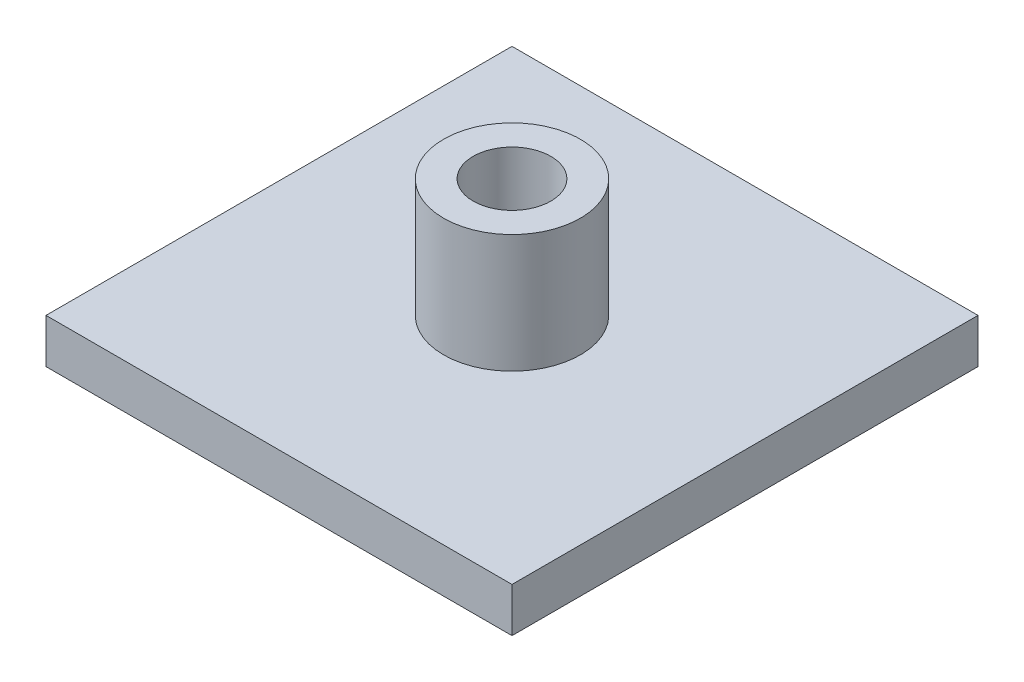
from build123d import *

# Parameters (mm, degrees)
SKETCH1_W           = 31.5
SKETCH1_H           = 31.5
BOSS_EXTRUDE1_DEPTH = 3
SKETCH2_R           = 4.625
SKETCH2_R_2         = 2.625
BOSS_EXTRUDE2_DEPTH = 8


with BuildPart() as part:
    # Sketch1 → Boss-Extrude1 (new body)
    with BuildSketch(Plane(origin=(0, 0, 0), x_dir=(1, 0, 0), z_dir=(0, 1, 0))):
        with Locations((15.75, 15.75)):
            Rectangle(SKETCH1_W, SKETCH1_H)
    extrude(amount=BOSS_EXTRUDE1_DEPTH)

    # Sketch2 → Boss-Extrude2 (add)
    with BuildSketch(Plane(origin=(0, 3, 0), x_dir=(1, 0, 0), z_dir=(0, 1, 0))):
        with Locations(Location((15.75, 15.75, 0), (0, 0, 270))):
            Circle(SKETCH2_R)
        with Locations(Location((15.75, 15.75, 0), (0, 0, 270))):
            Circle(SKETCH2_R_2, mode=Mode.SUBTRACT)
    extrude(amount=BOSS_EXTRUDE2_DEPTH)


solid = part.part
